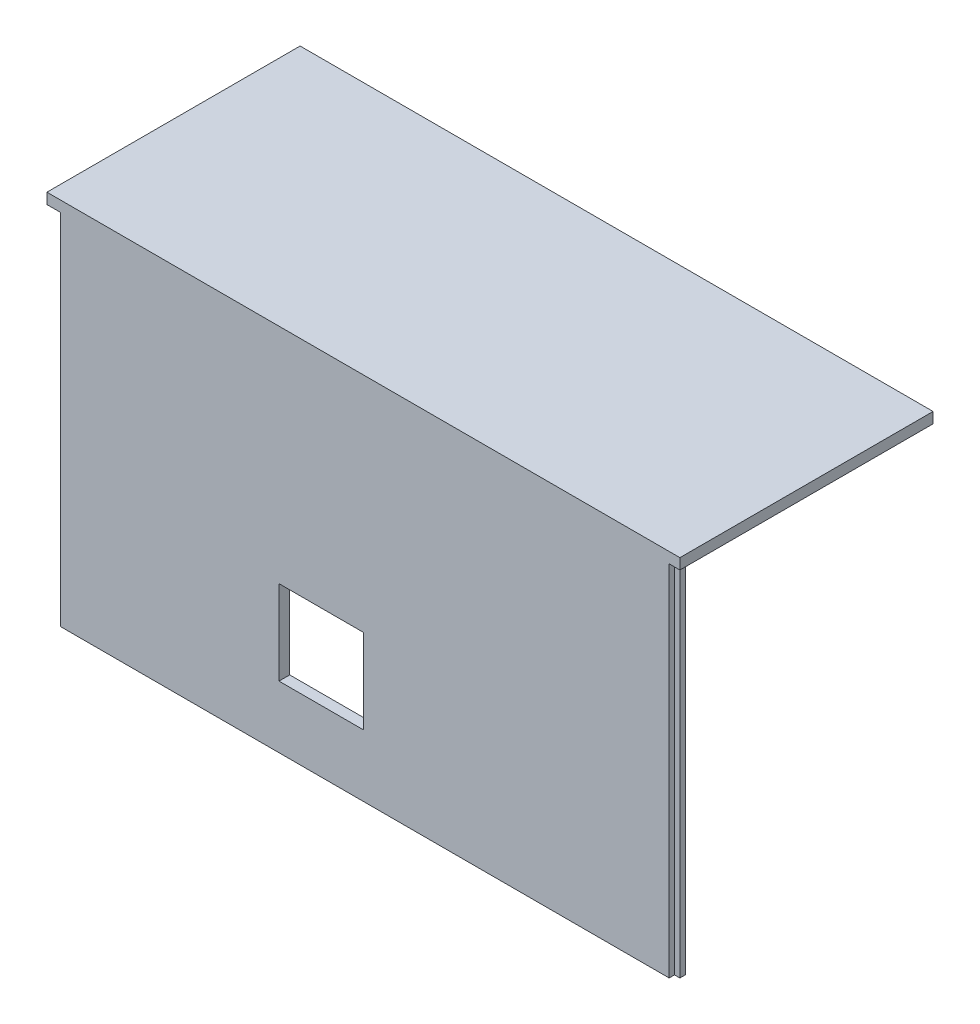
from build123d import *

# Parameters (mm, degrees)
SKETCH1_W           = 150
SKETCH1_H           = 85
BOSS_EXTRUDE1_DEPTH = 2.54
SKETCH2_W           = 20
SKETCH2_H           = 20
CUT_EXTRUDE1_DEPTH  = 2.54
SKETCH3_R           = 3
BOSS_EXTRUDE2_DEPTH = 8
SKETCH9_R           = 0.5
CUT_EXTRUDE7_DEPTH  = 4
CUT_EXTRUDE8_DEPTH  = 85
SKETCH11_W          = 150
SKETCH11_H          = 60
BOSS_EXTRUDE3_DEPTH = 2.54


with BuildPart() as part:
    # Sketch1 → Boss-Extrude1 (new body)
    with BuildSketch(Plane.XY):
        with Locations((2.158007809, 4.641833841)):
            Rectangle(SKETCH1_W, SKETCH1_H)
    extrude(amount=BOSS_EXTRUDE1_DEPTH)

    # Sketch2 → Cut-Extrude1 (cut)
    with BuildSketch(Plane(origin=(0, 0, 0), x_dir=(-1, 0, 0), z_dir=(0, 0, -1))):
        with Locations((7.841992191, -13.158166159)):
            Rectangle(SKETCH2_W, SKETCH2_H)
    extrude(amount=-CUT_EXTRUDE1_DEPTH, mode=Mode.SUBTRACT)

    # Sketch3 → Boss-Extrude2 (add)
    with BuildSketch(Plane(origin=(0, 0, 0), x_dir=(-1, 0, 0), z_dir=(0, 0, -1))):
        with Locations(Location((-51.158007809, -21.858166159, 0), (0, 0, 180))):
            Circle(SKETCH3_R)
        with Locations(Location((-16.158007809, -21.858166159, 0), (0, 0, 180))):
            Circle(SKETCH3_R)
    extrude(amount=BOSS_EXTRUDE2_DEPTH)

    # Sketch9 → Cut-Extrude7 (cut)
    with BuildSketch(Plane(origin=(0, 0, -8), x_dir=(-1, 0, 0), z_dir=(0, 0, -1))):
        with Locations((-51.158007809, -21.858166159)):
            Circle(SKETCH9_R)
        with Locations((-16.158007809, -21.858166159)):
            Circle(SKETCH9_R)
    extrude(amount=-CUT_EXTRUDE7_DEPTH, mode=Mode.SUBTRACT)

    # Sketch10 → Cut-Extrude8 (cut)
    with BuildSketch(Plane(origin=(0, 47.141833841, 0), x_dir=(1, 0, 0), z_dir=(0, 1, 0))):
        Polygon((-69.666992191, -1.27), (-69.666992191, -2.54), (-72.841992191, -2.54), (-72.841992191, 0), (-70.936992191, 0), (-70.936992191, -1.27), align=None)
        Polygon((75.888007809, 0), (75.888007809, -1.27), (74.618007809, -1.27), (74.618007809, -2.54), (77.158007809, -2.54), (77.158007809, 0), align=None)
    extrude(amount=-CUT_EXTRUDE8_DEPTH, mode=Mode.SUBTRACT)

    # Sketch11 → Boss-Extrude3 (add)
    with BuildSketch(Plane(origin=(0, 47.141833841, 0), x_dir=(1, 0, 0), z_dir=(0, 1, 0))):
        with Locations((2.158007809, 27.46)):
            Rectangle(SKETCH11_W, SKETCH11_H)
    extrude(amount=BOSS_EXTRUDE3_DEPTH)


solid = part.part
